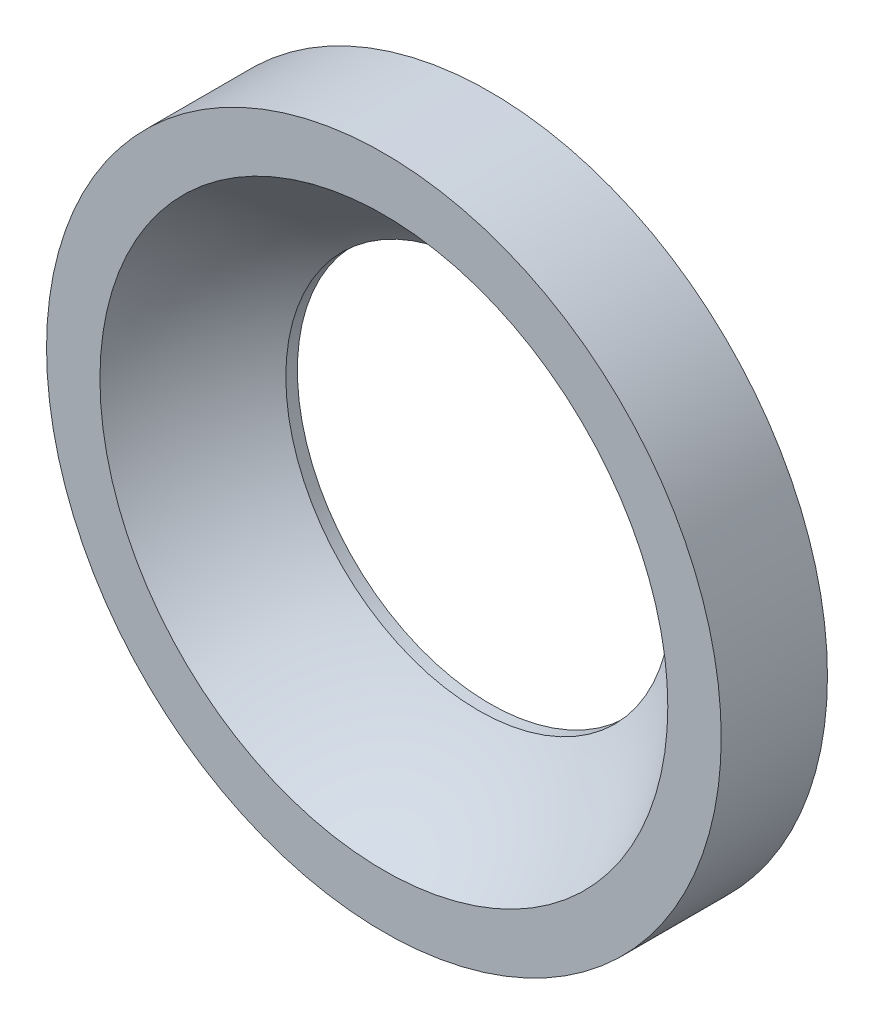
from build123d import *

# Parameters (mm, degrees)
SKETCH2_R           = 22.225
BOSS_EXTRUDE1_DEPTH = 7
SKETCH3_R           = 12.7
CUT_EXTRUDE1_DEPTH  = 33.200951073


with BuildPart() as part:
    # Sketch2 → Boss-Extrude1 (new body)
    with BuildSketch(Plane.XY):
        Circle(SKETCH2_R)
    extrude(amount=BOSS_EXTRUDE1_DEPTH)

    # Sketch3 → Cut-Extrude1 (cut, through all)
    with BuildSketch(Plane.XY.offset(7)):
        Circle(SKETCH3_R)
    extrude(amount=-CUT_EXTRUDE1_DEPTH, mode=Mode.SUBTRACT)

    # Sketch4 → Cut-Revolve1 (revolve, cut)
    with BuildSketch(Plane(origin=(0, 0, 0), x_dir=(1, 0, 0), z_dir=(0, 1, 0)), mode=Mode.PRIVATE) as cut_revolve1_sk:
        with BuildLine():
            Line((-18.706967285, -7), (0, -7))
            Line((0, -7), (0, -0.761013597))
            Line((0, -0.761013597), (-12.7, -0.761013597))
            ThreePointArc((-12.7, -0.761013597), (-16.010329052, -3.585072538), (-18.706967285, -7))
        make_face()
    revolve(cut_revolve1_sk.sketch.rotate(Axis((0, 0, -16.764248705), (0, 0, 1)), 180), axis=Axis((0, 0, -16.764248705), (0, 0, 1)), mode=Mode.SUBTRACT)


solid = part.part
